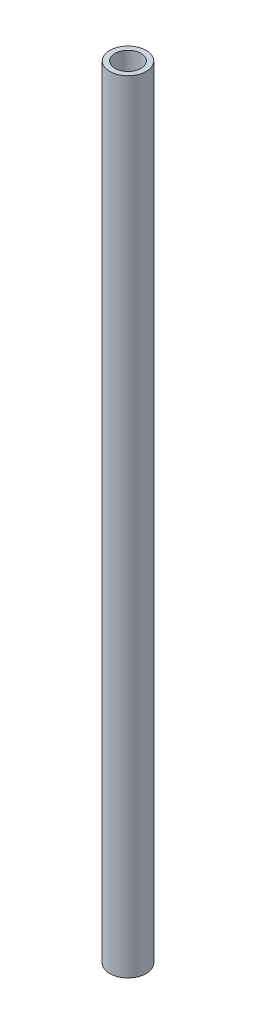
from build123d import *

# Parameters (mm, degrees)
SKETCH1_R           = 7
SKETCH1_R_2         = 4
BOSS_EXTRUDE1_DEPTH = 300
SKETCH2_R           = 5
CUT_EXTRUDE1_DEPTH  = 31
CUT_EXTRUDE2_START  = -269
SKETCH2_2_R         = 5
CUT_EXTRUDE2_DEPTH  = 31


with BuildPart() as part:
    # Sketch1 → Boss-Extrude1 (new body)
    with BuildSketch(Plane(origin=(0, 0, 0), x_dir=(1, 0, 0), z_dir=(0, 1, 0))):
        with Locations(Location((0, 0, 0), (0, 0, 270))):
            Circle(SKETCH1_R)
        with Locations(Location((0, 0, 0), (0, 0, 270))):
            Circle(SKETCH1_R_2, mode=Mode.SUBTRACT)
    extrude(amount=BOSS_EXTRUDE1_DEPTH)

    # Sketch2 → Cut-Extrude1 (cut)
    with BuildSketch(Plane(origin=(0, 300, 0), x_dir=(1, 0, 0), z_dir=(0, 1, 0))):
        with Locations(Location((0, 0, 0), (0, 0, 270))):
            Circle(SKETCH2_R)
    extrude(amount=-CUT_EXTRUDE1_DEPTH, mode=Mode.SUBTRACT)

    # Sketch2<2> → Cut-Extrude2 (cut)
    with BuildSketch(Plane(origin=(0, 300, 0), x_dir=(1, 0, 0), z_dir=(0, 1, 0)).offset(CUT_EXTRUDE2_START)):
        with Locations(Location((0, 0, 0), (0, 0, 270))):
            Circle(SKETCH2_2_R)
    extrude(amount=-CUT_EXTRUDE2_DEPTH, mode=Mode.SUBTRACT)


solid = part.part
